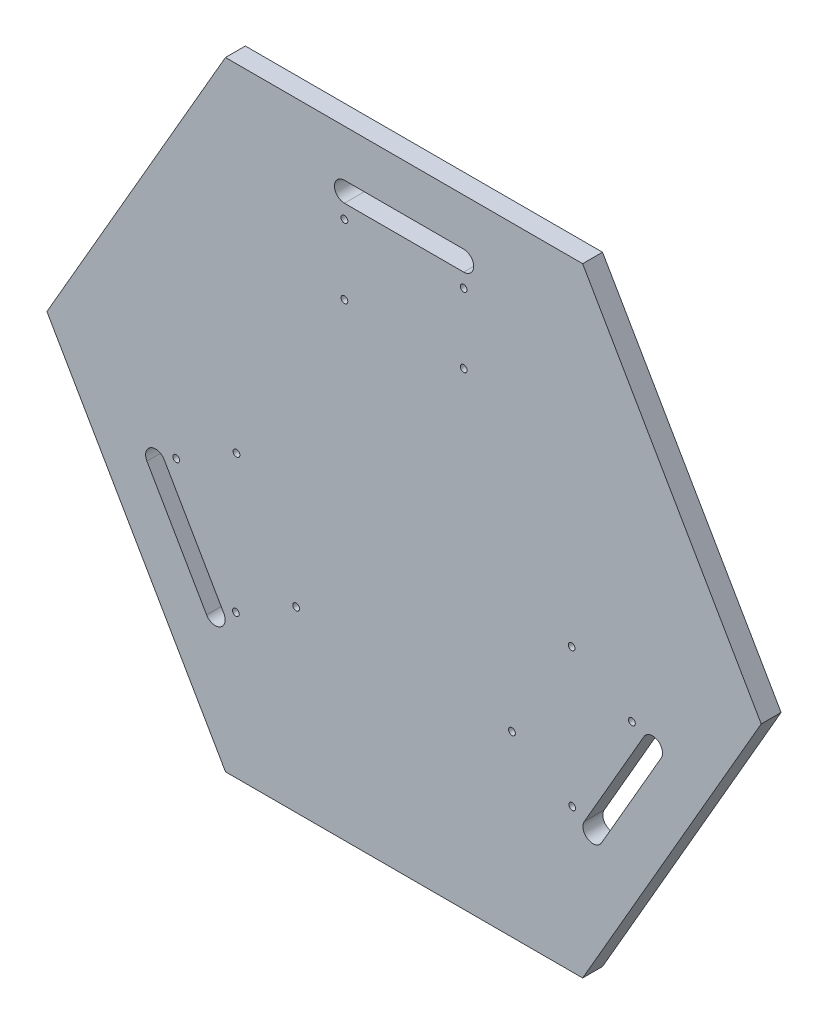
from build123d import *

# Parameters (mm, degrees)
BOSS_EXTRUDE1_DEPTH  = 5
CUT_EXTRUDE1_DEPTH   = 238.855042953
M3_CLEARANCE_HOLE1_D = 3.4
CIRPATTERN1_COUNT    = 3


with BuildPart() as part:
    # Sketch2 → Boss-Extrude1 (new, symmetric)
    with BuildSketch(Plane.XY):
        Polygon((-89.821268129, 155.575), (-179.642536258, 0), (-89.821268129, -155.575), (89.821268129, -155.575), (179.642536258, 0), (89.821268129, 155.575), align=None)
    extrude(amount=BOSS_EXTRUDE1_DEPTH, both=True)

    # Sketch3 → Cut-Extrude1 (cut, through all)
    with BuildSketch(Plane.XY.offset(5)):
        with BuildLine():
            Line((-29.999999999, 132), (30.000000001, 132))
            ThreePointArc((30.000000001, 132), (35.000000001, 127), (30.000000001, 122))
            Line((30.000000001, 122), (-29.999999999, 122))
            ThreePointArc((-29.999999999, 122), (-34.999999999, 127), (-29.999999999, 132))
        make_face()
    cut_extrude1 = extrude(amount=-CUT_EXTRUDE1_DEPTH, mode=Mode.SUBTRACT)

    # M3 Clearance Hole1 (through all)
    with Locations(Plane.XY.offset(5)):
        with Locations((-30.000000001, 115), (30.000000001, 115), (-30.000000001, 80), (30.000000001, 80)):
            m3_clearance_hole1 = Hole(M3_CLEARANCE_HOLE1_D / 2)

    # CirPattern1: Cut-Extrude1, M3 Clearance Hole1 ×3 about axis
    cirpattern1_axis = Axis((0, 0, -20.250000596), (0, 0, 1))
    add([cut_extrude1.rotate(cirpattern1_axis, i * 360 / CIRPATTERN1_COUNT) for i in range(1, CIRPATTERN1_COUNT)], mode=Mode.SUBTRACT)
    add([m3_clearance_hole1.rotate(cirpattern1_axis, i * 360 / CIRPATTERN1_COUNT) for i in range(1, CIRPATTERN1_COUNT)], mode=Mode.SUBTRACT)


solid = part.part
